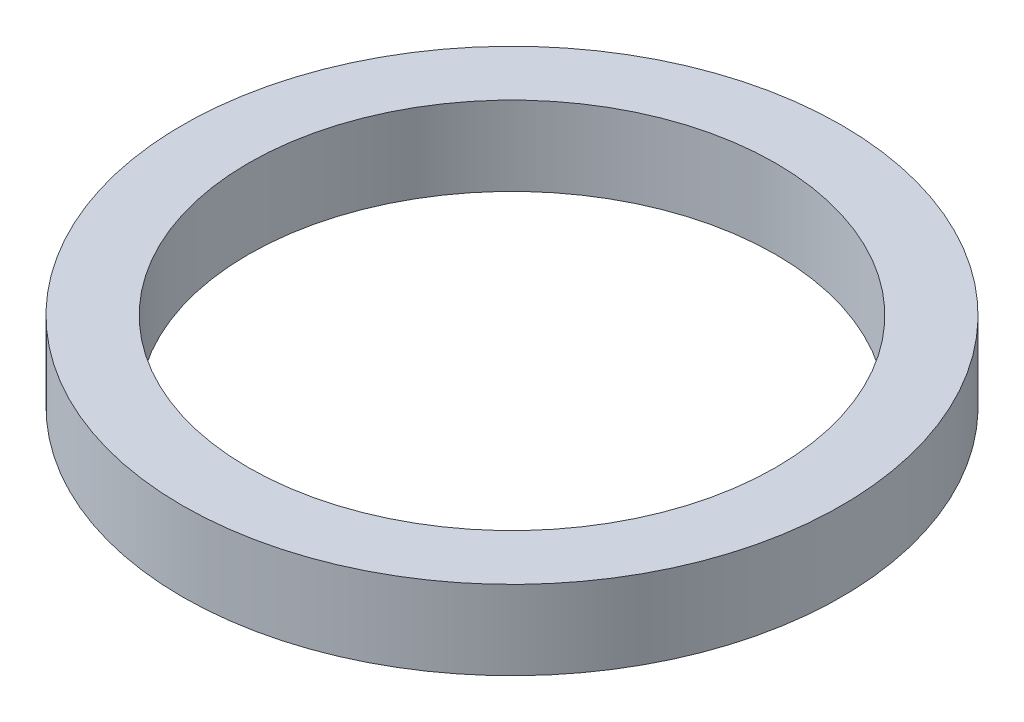
from build123d import *

# Parameters (mm, degrees)
SKETCH1_R           = 25
SKETCH1_R_2         = 20
BOSS_EXTRUDE1_DEPTH = 6


with BuildPart() as part:
    # Sketch1 → Boss-Extrude1 (new body)
    with BuildSketch(Plane(origin=(0, 0, 0), x_dir=(1, 0, 0), z_dir=(0, 1, 0))):
        with Locations(Location((0, 0, 0), (0, 0, 270))):
            Circle(SKETCH1_R)
        with Locations(Location((0, 0, 0), (0, 0, 270))):
            Circle(SKETCH1_R_2, mode=Mode.SUBTRACT)
    extrude(amount=BOSS_EXTRUDE1_DEPTH)


solid = part.part
